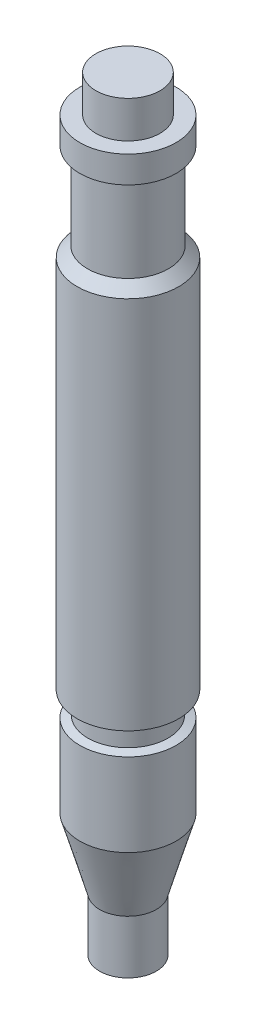
from build123d import *


with BuildPart() as part:
    # 草图1 → 旋转1 (revolve)
    with BuildSketch(Plane.XY, mode=Mode.PRIVATE) as revolve_1_sk:
        Polygon((0, 81.923883013), (6, 81.923883013), (6, 75.010759902), (9, 75.010759902), (9, 70.010759902), (7.57339192, 70.010759902), (7.57339192, 53.850491093), (9.5, 51.923883013), (9.5, -18.076116987), (0, -18.076116987), align=None)
    revolve(revolve_1_sk.sketch.rotate(Axis((0, 26.539226881, 0), (0, -1, 0)), 90), axis=Axis((0, 26.539226881, 0), (0, -1, 0)))

    # 草图2 → 旋转2 (revolve)
    with BuildSketch(Plane.XY, mode=Mode.PRIVATE) as revolve_2_sk:
        Polygon((7.5, -18.076116987), (7.5, -22.220066431), (9, -22.648998158), (9, -38.155089675), (5.305174294, -51.076116987), (5.305174294, -61.076116987), (3, -61.076116987), (3, -40.670715688), (0, -40.670715688), (0, -18.076116987), align=None)
    revolve(revolve_2_sk.sketch.rotate(Axis((0, -18.076116987, 0), (0, -1, 0)), 90), axis=Axis((0, -18.076116987, 0), (0, -1, 0)))


solid = part.part
